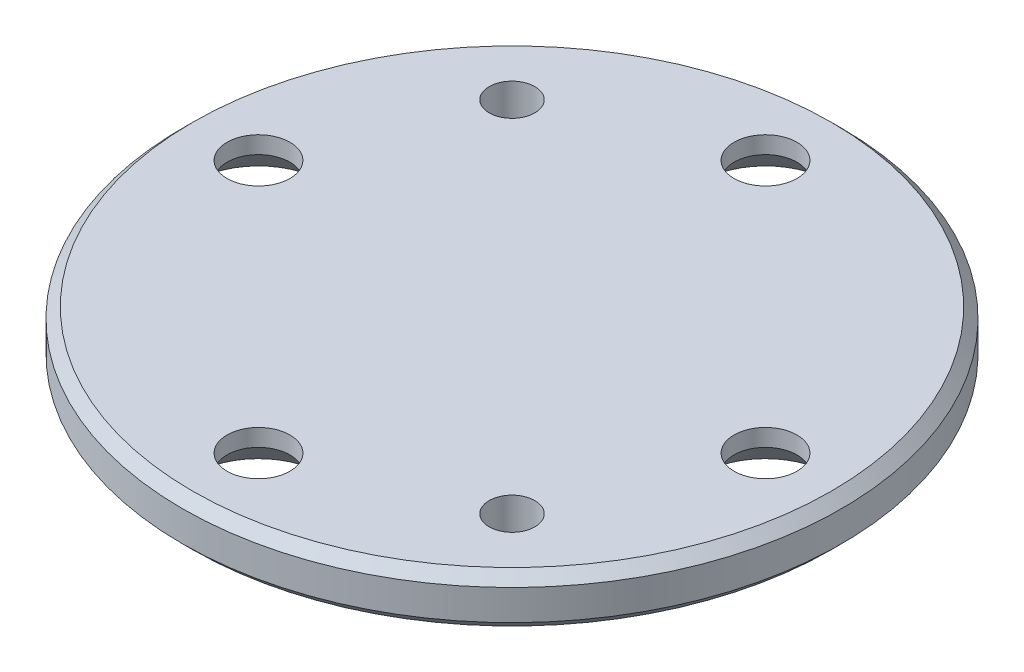
from build123d import *

# Parameters (mm, degrees)
SKETCH1_R           = 32.5
SKETCH1_R_2         = 3.1
SKETCH1_R_3         = 2.25
BOSS_EXTRUDE1_DEPTH = 5
CHAMFER1_SIZE       = 3.3
CHAMFER2_SIZE       = 1


with BuildPart() as part:
    # Sketch1 → Boss-Extrude1 (new body)
    with BuildSketch(Plane(origin=(0, 0, 0), x_dir=(1, 0, 0), z_dir=(0, 1, 0))):
        Circle(SKETCH1_R)
        with Locations((0, 25)):
            Circle(SKETCH1_R_2, mode=Mode.SUBTRACT)
        with Locations((25, 0)):
            Circle(SKETCH1_R_2, mode=Mode.SUBTRACT)
        with Locations((0, -25)):
            Circle(SKETCH1_R_2, mode=Mode.SUBTRACT)
        with Locations((-25, 0)):
            Circle(SKETCH1_R_2, mode=Mode.SUBTRACT)
        with Locations((-17.67766953, 17.67766953)):
            Circle(SKETCH1_R_3, mode=Mode.SUBTRACT)
        with Locations((17.67766953, -17.67766953)):
            Circle(SKETCH1_R_3, mode=Mode.SUBTRACT)
    extrude(amount=BOSS_EXTRUDE1_DEPTH)

    # Chamfer1
    chamfer1_edges = [part.edges().sort_by_distance(p)[0] for p in [
        (-3.1, 0, -25),
        (21.9, 0, 0),
        (-3.1, 0, 25),
        (-28.1, 0, 0),
    ]]
    chamfer(chamfer1_edges, length=CHAMFER1_SIZE)

    # Chamfer2
    chamfer2_edges = [part.edges().sort_by_distance(p)[0] for p in [
        (-32.5, 5, 0),
        (-32.5, 0, 0),
    ]]
    chamfer(chamfer2_edges, length=CHAMFER2_SIZE)


solid = part.part
